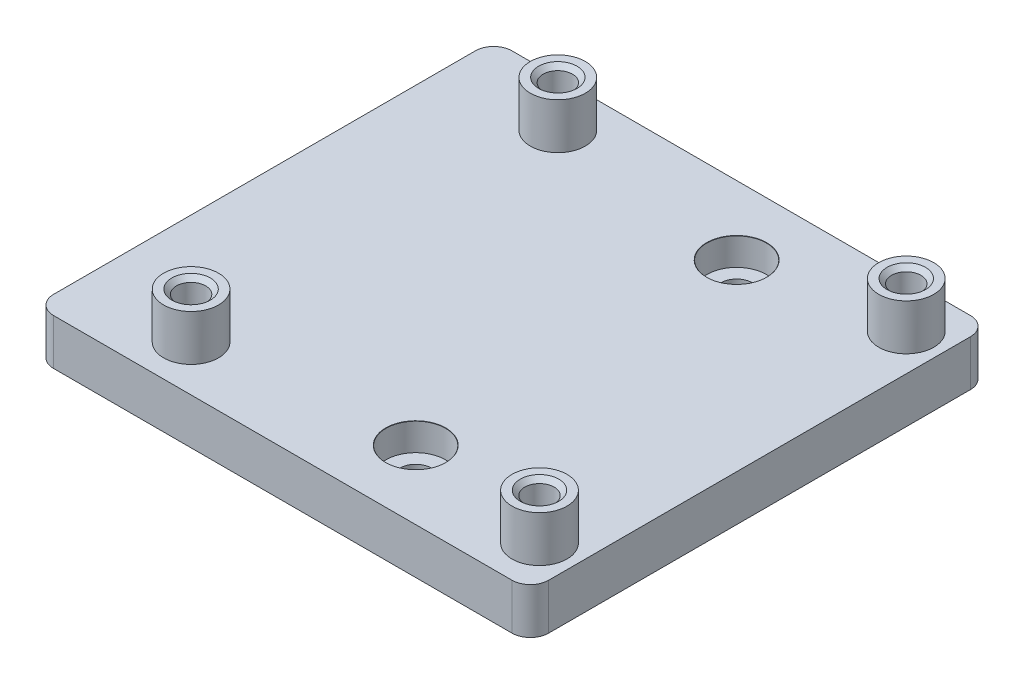
from build123d import *

# Parameters (mm, degrees)
SKETCH1_W                     = 54
SKETCH1_H                     = 50
BOSS_EXTRUDE1_DEPTH           = 5
SKETCH2_R                     = 3
SKETCH2_R_2                   = 1.6
BOSS_EXTRUDE2_DEPTH           = 5
CBORE_FOR_M3_SHCS1_AT_2_COUNT = 2
CBORE_FOR_M3_SHCS1_AT_2_PITCH = 35
CHAMFER1_SIZE                 = 0.5
FILLET1_R                     = 2


with BuildPart() as part:
    # Sketch1 → Boss-Extrude1 (new body)
    with BuildSketch(Plane(origin=(0, 0, 0), x_dir=(1, 0, 0), z_dir=(0, 1, 0))):
        with Locations((27, 25)):
            Rectangle(SKETCH1_W, SKETCH1_H)
    extrude(amount=BOSS_EXTRUDE1_DEPTH)

    # Sketch2 → Boss-Extrude2 (add)
    # profile 1 of 4: a face of its own
    with BuildSketch(Plane(origin=(0, 5, 0), x_dir=(1, 0, 0), z_dir=(0, 1, 0))):
        with Locations(Location((50, 5, 0), (0, 0, 90))):
            Circle(SKETCH2_R)
        with Locations(Location((50, 5, 0), (0, 0, 270))):
            Circle(SKETCH2_R_2, mode=Mode.SUBTRACT)
    # profile 2 of 4: a face of its own
    with BuildSketch(Plane(origin=(0, 5, 0), x_dir=(1, 0, 0), z_dir=(0, 1, 0))):
        with Locations(Location((50, 45, 0), (0, 0, 90))):
            Circle(SKETCH2_R)
        with Locations(Location((50, 45, 0), (0, 0, 270))):
            Circle(SKETCH2_R_2, mode=Mode.SUBTRACT)
    # profile 3 of 4: a face of its own
    with BuildSketch(Plane(origin=(0, 5, 0), x_dir=(1, 0, 0), z_dir=(0, 1, 0))):
        with Locations(Location((12, 45, 0), (0, 0, 90))):
            Circle(SKETCH2_R)
        with Locations(Location((12, 45, 0), (0, 0, 270))):
            Circle(SKETCH2_R_2, mode=Mode.SUBTRACT)
    # profile 4 of 4: a face of its own
    with BuildSketch(Plane(origin=(0, 5, 0), x_dir=(1, 0, 0), z_dir=(0, 1, 0))):
        with Locations(Location((12, 5, 0), (0, 0, 90))):
            Circle(SKETCH2_R)
        with Locations(Location((12, 5, 0), (0, 0, 270))):
            Circle(SKETCH2_R_2, mode=Mode.SUBTRACT)
    extrude(amount=BOSS_EXTRUDE2_DEPTH)

    # Sketch4 → CBORE for M3 SHCS1 (revolve, cut)
    with BuildSketch(Plane(origin=(34, 5, -42.5), x_dir=(0, 0, 1), z_dir=(1, 0, 0))):
        Polygon((0, 0), (0, 5), (1.7, 5), (1.7, 3), (3.25, 3), (3.25, 0.025), (3.275, 0), align=None)
    cbore_for_m3_shcs1 = revolve(axis=Axis((34, 11.35, -42.5), (0, -1, 0)), mode=Mode.SUBTRACT)

    # CBORE for M3 SHCS1 at 2: CBORE for M3 SHCS1 ×2
    with Locations(*[(0, 0, i * CBORE_FOR_M3_SHCS1_AT_2_PITCH) for i in range(1, CBORE_FOR_M3_SHCS1_AT_2_COUNT)]):
        add(cbore_for_m3_shcs1, mode=Mode.SUBTRACT)

    # Chamfer1
    chamfer1_edges = [part.edges().sort_by_distance(p)[0] for p in [
        (12, 10, -6.6),
        (12, 10, -46.6),
        (50, 10, -46.6),
        (50, 10, -6.6),
    ]]
    chamfer(chamfer1_edges, length=CHAMFER1_SIZE)

    # Fillet1
    fillet1_edges = [part.edges().sort_by_distance(p)[0] for p in [
        (0, 2.5, -50),
        (54, 2.5, -50),
        (54, 2.5, 0),
        (0, 2.5, 0),
    ]]
    fillet(fillet1_edges, radius=FILLET1_R)


solid = part.part
